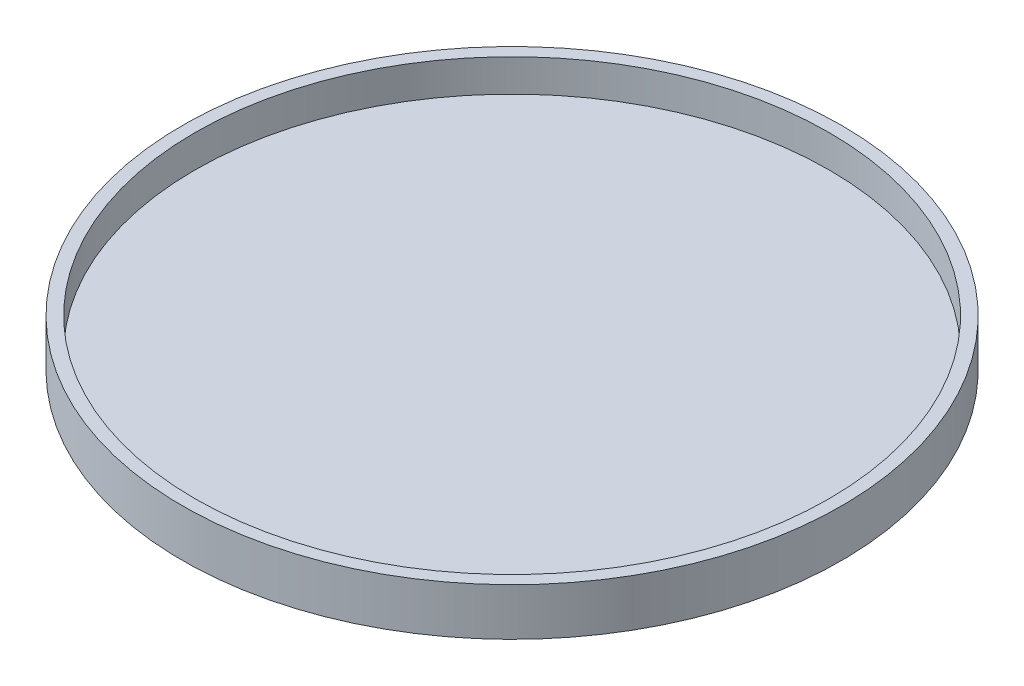
from build123d import *

# Parameters (mm, degrees)
SKETCH1_R           = 66.125
SKETCH1_R_2         = 63.625
BOSS_EXTRUDE1_DEPTH = 6.5
BOSS_EXTRUDE2_START = -3
SKETCH1_2_R         = 66.125
BOSS_EXTRUDE2_DEPTH = 3
SKETCH2_R           = 2.05
BOSS_EXTRUDE3_DEPTH = 17
FILLET2_R           = 4


with BuildPart() as part:
    # Sketch1 → Boss-Extrude1 (new body)
    with BuildSketch(Plane(origin=(0, 0, 0), x_dir=(1, 0, 0), z_dir=(0, 1, 0))):
        Circle(SKETCH1_R)
        Circle(SKETCH1_R_2, mode=Mode.SUBTRACT)
    extrude(amount=BOSS_EXTRUDE1_DEPTH)

    # Sketch1<2> → Boss-Extrude2 (add)
    with BuildSketch(Plane(origin=(0, 0, 0), x_dir=(1, 0, 0), z_dir=(0, 1, 0)).offset(BOSS_EXTRUDE2_START)):
        Circle(SKETCH1_2_R)
    extrude(amount=BOSS_EXTRUDE2_DEPTH)

    # Sketch2 → Boss-Extrude3 (add)
    # profile 1 of 3: a face of its own
    with BuildSketch(Plane.XZ.offset(3)):
        with BuildLine():
            Line((-8.75, 37.56233108), (-11.05949818, 37.56233108))
            ThreePointArc((-11.05949818, 37.56233108), (-13.925946075, 33.87832634), (-15.607142857, 29.523789414))
            ThreePointArc((-15.607142857, 29.523789414), (-21.5, 26), (-15.607142857, 22.476210586))
            ThreePointArc((-15.607142857, 22.476210586), (0, 10), (15.607142857, 22.476210586))
            ThreePointArc((15.607142857, 22.476210586), (21.5, 26), (15.607142857, 29.523789414))
            ThreePointArc((15.607142857, 29.523789414), (13.925946075, 33.87832634), (11.05949818, 37.56233108))
            Line((11.05949818, 37.56233108), (8.75, 37.56233108))
            ThreePointArc((8.75, 37.56233108), (0, 11.5), (-8.75, 37.56233108))
        make_face()
        with Locations((-17.5, 26)):
            Circle(SKETCH2_R, mode=Mode.SUBTRACT)
        with Locations((17.5, 26)):
            Circle(SKETCH2_R, mode=Mode.SUBTRACT)
    # profile 2 of 3: a face of its own
    with BuildSketch(Plane.XZ.offset(3)):
        with BuildLine():
            Line((36.904932941, -11.203443257), (38.059682031, -9.203359163))
            ThreePointArc((38.059682031, -9.203359163), (36.302464286, -4.878940097), (33.371923077, -1.245712512))
            ThreePointArc((33.371923077, -1.245712512), (33.266660498, 5.619546181), (27.268540777, 2.278076902))
            ThreePointArc((27.268540777, 2.278076902), (8.660254038, -5), (11.661397919, -24.754287488))
            ThreePointArc((11.661397919, -24.754287488), (11.766660498, -31.619546181), (17.76478022, -28.278076902))
            ThreePointArc((17.76478022, -28.278076902), (22.376518211, -28.999386243), (27.00018385, -28.358971917))
            Line((27.00018385, -28.358971917), (28.154932941, -26.358887823))
            ThreePointArc((28.154932941, -26.358887823), (9.959292144, -5.75), (36.904932941, -11.203443257))
        make_face()
        with Locations((31.266660498, 2.155444566)):
            Circle(SKETCH2_R, mode=Mode.SUBTRACT)
        with Locations((13.766660498, -28.155444566)):
            Circle(SKETCH2_R, mode=Mode.SUBTRACT)
    # profile 3 of 3: a face of its own
    with BuildSketch(Plane.XZ.offset(3)):
        with BuildLine():
            Line((-28.154932941, -26.358887823), (-27.00018385, -28.358971917))
            ThreePointArc((-27.00018385, -28.358971917), (-22.376518211, -28.999386243), (-17.76478022, -28.278076902))
            ThreePointArc((-17.76478022, -28.278076902), (-11.766660498, -31.619546181), (-11.661397919, -24.754287488))
            ThreePointArc((-11.661397919, -24.754287488), (-8.660254038, -5), (-27.268540777, 2.278076902))
            ThreePointArc((-27.268540777, 2.278076902), (-33.266660498, 5.619546181), (-33.371923077, -1.245712512))
            ThreePointArc((-33.371923077, -1.245712512), (-36.302464286, -4.878940097), (-38.059682031, -9.203359163))
            Line((-38.059682031, -9.203359163), (-36.904932941, -11.203443257))
            ThreePointArc((-36.904932941, -11.203443257), (-9.959292144, -5.75), (-28.154932941, -26.358887823))
        make_face()
        with Locations((-13.766660498, -28.155444566)):
            Circle(SKETCH2_R, mode=Mode.SUBTRACT)
        with Locations((-31.266660498, 2.155444566)):
            Circle(SKETCH2_R, mode=Mode.SUBTRACT)
    extrude(amount=BOSS_EXTRUDE3_DEPTH)

    # Fillet2
    fillet2_edges = [part.edges().sort_by_distance(p)[0] for p in [
        (-13.925946075, -3, 33.87832634),
        (-21.5, -3, 26),
        (0, -3, 10),
        (13.925946075, -3, 33.87832634),
        (21.5, -3, 26),
        (36.302464286, -3, -4.878940097),
        (33.266660498, -3, 5.619546181),
        (8.660254038, -3, -5),
        (11.766660498, -3, -31.619546181),
        (22.376518211, -3, -28.999386243),
        (-36.302464286, -3, -4.878940097),
        (-33.266660498, -3, 5.619546181),
        (-22.376518211, -3, -28.999386243),
        (-11.766660498, -3, -31.619546181),
        (-8.660254038, -3, -5),
    ]]
    fillet(fillet2_edges, radius=FILLET2_R)


solid = part.part
